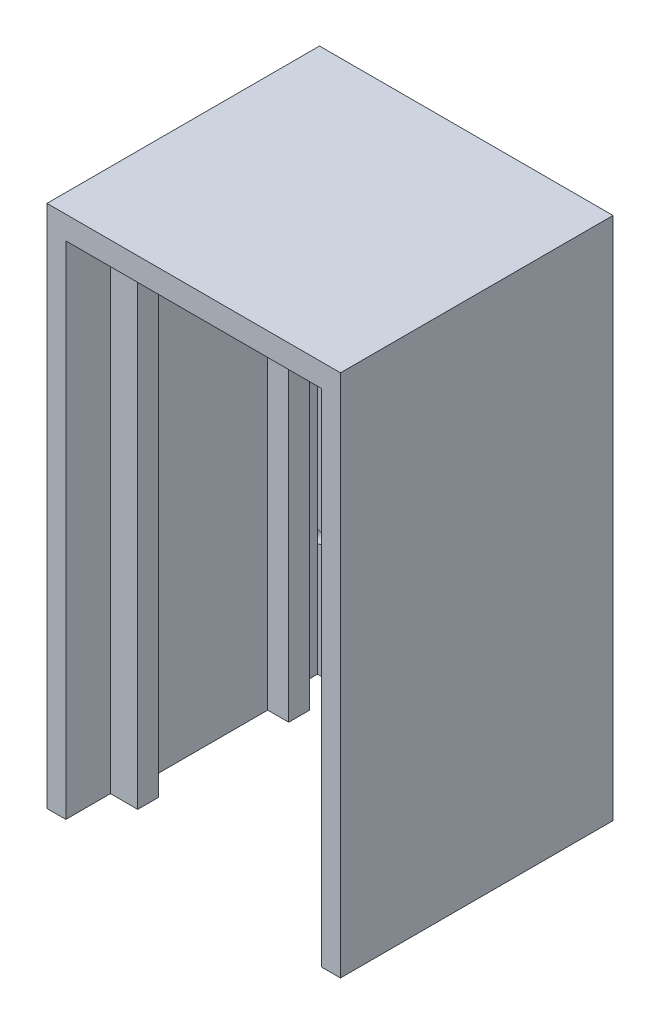
from build123d import *

# Parameters (mm, degrees)
SKETCH1_W           = 72
SKETCH1_H           = 125
BOSS_EXTRUDE1_DEPTH = 5
SKETCH2_R           = 1.5
CUT_EXTRUDE6_DEPTH  = 5
BOSS_EXTRUDE2_DEPTH = 60
BOSS_EXTRUDE3_DEPTH = 119.5
SKETCH5_W           = 1
SKETCH5_H           = 65
SKETCH5_W_2         = 4
CUT_EXTRUDE7_DEPTH  = 158


with BuildPart() as part:
    # Sketch1 → Boss-Extrude1 (new body)
    with BuildSketch(Plane(origin=(0, 0, 0), x_dir=(-1, 0, 0), z_dir=(0, 0, 1))):
        with Locations((0, -8.5305)):
            Rectangle(SKETCH1_W, SKETCH1_H)
    extrude(amount=BOSS_EXTRUDE1_DEPTH)

    # Sketch2 → Cut-Extrude6 (cut)
    with BuildSketch(Plane(origin=(0, 0, 0), x_dir=(-1, 0, 0), z_dir=(0, 0, 1))):
        with Locations(Location((30.5, -67.5305, 0), (0, 0, 180))):
            Circle(SKETCH2_R)
        with Locations(Location((-30.5, -67.5305, 0), (0, 0, 180))):
            Circle(SKETCH2_R)
        with Locations(Location((30.5, 25.4695, 0), (0, 0, 180))):
            Circle(SKETCH2_R)
        with Locations(Location((-30.5, 25.4695, 0), (0, 0, 180))):
            Circle(SKETCH2_R)
        with Locations(Location((0, -21.0305, 0), (0, 0, 180))):
            Circle(SKETCH2_R)
    extrude(amount=CUT_EXTRUDE6_DEPTH, mode=Mode.SUBTRACT)

    # Sketch3 → Boss-Extrude2 (add)
    with BuildSketch(Plane.XY.offset(5)):
        Polygon((-30.5, -53.9695), (-30.5, 65.5305), (30.5, 65.5305), (30.5, -53.9695), (36, -53.9695), (36, 71.0305), (-36, 71.0305), (-36, -53.9695), align=None)
    extrude(amount=BOSS_EXTRUDE2_DEPTH)

    # Sketch4 → Boss-Extrude3 (add)
    with BuildSketch(Plane.XZ.offset(53.9695)):
        Polygon((-24, 18.356334593), (-29, 18.356334593), (-29, 49.356334593), (-24, 49.356334593), (-24, 54.356334593), (-30.5, 54.356334593), (-30.5, 13.356334593), (-24, 13.356334593), align=None)
        Polygon((29, 18.356334593), (24, 18.356334593), (24, 13.356334593), (30.5, 13.356334593), (30.5, 54.356334593), (24, 54.356334593), (24, 49.356334593), (29, 49.356334593), align=None)
    extrude(amount=-BOSS_EXTRUDE3_DEPTH)

    # Sketch5 → Cut-Extrude7 (cut)
    with BuildSketch(Plane(origin=(0, 71.0305, 0), x_dir=(1, 0, 0), z_dir=(0, 1, 0))):
        with Locations((-35.5, -32.5)):
            Rectangle(SKETCH5_W, SKETCH5_H)
        with Locations((-38, -32.5)):
            Rectangle(SKETCH5_W_2, SKETCH5_H)
        with Locations((38, -32.5)):
            Rectangle(SKETCH5_W_2, SKETCH5_H)
        with Locations((35.5, -32.5)):
            Rectangle(SKETCH5_W, SKETCH5_H)
    extrude(amount=-CUT_EXTRUDE7_DEPTH, mode=Mode.SUBTRACT)


solid = part.part
